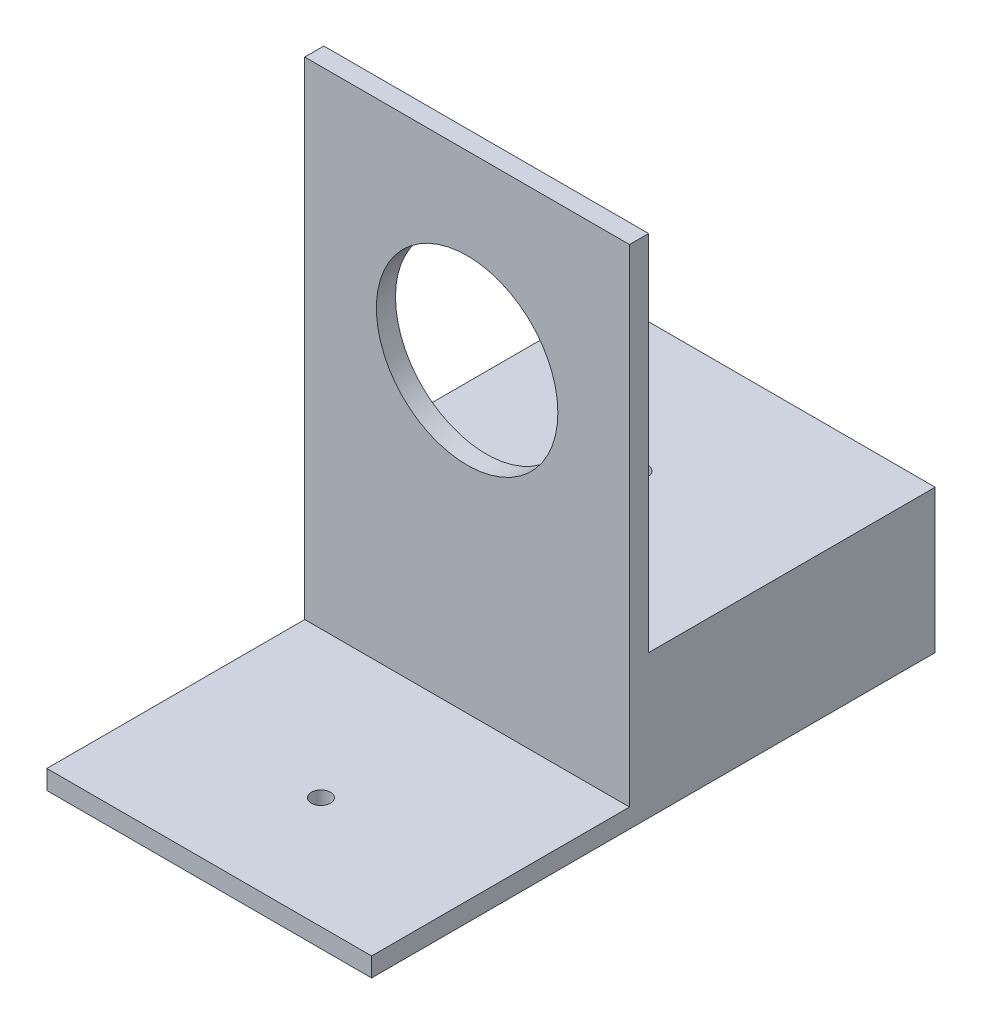
from build123d import *

# Parameters (mm, degrees)
SKETCH1_W                    = 34
SKETCH1_H                    = 53
BOSS_EXTRUDE1_DEPTH          = 2
SKETCH2_W                    = 34
SKETCH2_H                    = 2
BOSS_EXTRUDE2_DEPTH          = 27
SKETCH3_W                    = 34
SKETCH3_H                    = 15
BOSS_EXTRUDE3_DEPTH          = 30
SKETCH4_R                    = 9.5
CUT_EXTRUDE1_DEPTH           = 71.632853546
F_94_0_0071_DIAMETER_HOLE1_D = 2.000000064


with BuildPart() as part:
    # Sketch1 → Boss-Extrude1 (new body)
    with BuildSketch(Plane.XY):
        with Locations((17, 26.5)):
            Rectangle(SKETCH1_W, SKETCH1_H)
    extrude(amount=BOSS_EXTRUDE1_DEPTH)

    # Sketch2 → Boss-Extrude2 (add)
    with BuildSketch(Plane.XY.offset(2)):
        with Locations((17, 1)):
            Rectangle(SKETCH2_W, SKETCH2_H)
    extrude(amount=BOSS_EXTRUDE2_DEPTH)

    # Sketch3 → Boss-Extrude3 (add)
    with BuildSketch(Plane(origin=(0, 0, 0), x_dir=(-1, 0, 0), z_dir=(0, 0, -1))):
        with Locations((-17, 7.5)):
            Rectangle(SKETCH3_W, SKETCH3_H)
    extrude(amount=BOSS_EXTRUDE3_DEPTH)

    # Sketch4 → Cut-Extrude1 (cut, through all)
    with BuildSketch(Plane.XY.offset(2)):
        with Locations((17, 34)):
            Circle(SKETCH4_R)
    extrude(amount=-CUT_EXTRUDE1_DEPTH, mode=Mode.SUBTRACT)

    # #94 (0.0071) Diameter Hole1 (through all)
    with Locations(Plane(origin=(0, 0, 0), x_dir=(-1, 0, 0), z_dir=(0, -1, 0))):
        with Locations((-17, -17.304753764), (-17, 15.945587516)):
            Hole(F_94_0_0071_DIAMETER_HOLE1_D / 2)


solid = part.part
